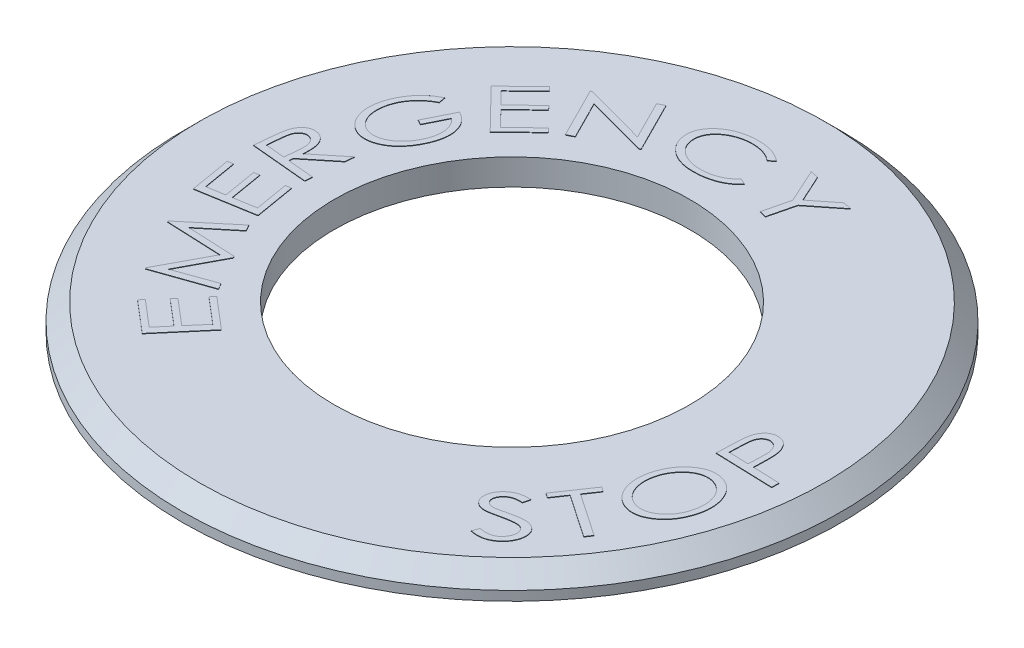
from build123d import *

# Parameters (mm, degrees)
SKETCH1_R         = 20
SKETCH1_R_2       = 10.795
EXTRUDE1_DEPTH    = 1.5875
CHAMFER1_SIZE     = 1.016
EXTRUDE3_DEPTH    = 0.508
CIRPATTERN1_COUNT = 8
SKETCH4_R         = 13.208
SKETCH4_R_2       = 11.557
EXTRUDE4_DEPTH    = 0.508
EXTRUDE5_DEPTH    = 0.0254


with BuildPart() as part:
    # Sketch1 → Extrude1 (new body)
    with BuildSketch(Plane(origin=(0, 0, 0), x_dir=(1, 0, 0), z_dir=(0, 1, 0))):
        Circle(SKETCH1_R)
        Circle(SKETCH1_R_2, mode=Mode.SUBTRACT)
    extrude(amount=EXTRUDE1_DEPTH)

    # Chamfer1
    chamfer1_edges = [part.edges().sort_by_distance(p)[0] for p in [
        (-20, 1.5875, 0),
    ]]
    chamfer(chamfer1_edges, length=CHAMFER1_SIZE)

    # Sketch3 → Extrude3 (cut)
    with BuildSketch(Plane.XZ):
        with BuildLine():
            ThreePointArc((18.07099166, 6.598477432), (11.130144468, 15.691415746), (0.254, 19.236323141))
            Line((0.254, 19.236323141), (0.254, 13.967690718))
            ThreePointArc((0.254, 13.967690718), (5.441836265, 12.866519267), (9.845405272, 9.911049139))
            Line((9.845405272, 9.911049139), (18.07099166, 6.598477432))
        make_face()
    extrude3 = extrude(amount=-EXTRUDE3_DEPTH, mode=Mode.SUBTRACT)

    # CirPattern1: Extrude3 ×8 about axis
    cirpattern1_axis = Axis((0, 24.887283079, 0), (0, -1, 0))
    for i in range(1, CIRPATTERN1_COUNT):
        add(extrude3.rotate(cirpattern1_axis, i * 360 / CIRPATTERN1_COUNT), mode=Mode.SUBTRACT)

    # Sketch4 → Extrude4 (cut)
    with BuildSketch(Plane.XZ):
        Circle(SKETCH4_R)
        Circle(SKETCH4_R_2, mode=Mode.SUBTRACT)
    extrude(amount=-EXTRUDE4_DEPTH, mode=Mode.SUBTRACT)

    # Sketch5 → Extrude5 (add)
    # profile 1 of 13: a face of its own
    with BuildSketch(Plane(origin=(0, 1.5875, 0), x_dir=(1, 0, 0), z_dir=(0, 1, 0))):
        Polygon((2.24862551, 15.919420056), (2.739207107, 15.798841714), (3.487481847, 14.161732339), (4.891702767, 15.269675048), (5.381595345, 15.149785725), (3.610816265, 13.743497747), (3.220831456, 12.15393069), (2.802596864, 12.256594535), (3.192581673, 13.846161593), align=None)
    # profile 2 of 13: a face of its own
    with BuildSketch(Plane(origin=(0, 1.5875, 0), x_dir=(1, 0, 0), z_dir=(0, 1, 0))):
        with BuildLine():
            Line((0.64804368, 15.401176133), (0.326960781, 15.160708469))
            add(Edge.make_bspline(
                [(0.326960781, 15.160708469), (0.300509182, 15.181626543), (0.247667412, 15.223414114), (0.165051543, 15.281603356), (0.078463133, 15.333605771), (-0.010446619, 15.382256657), (-0.102962938, 15.425710526), (-0.198877847, 15.4639264), (-0.297229972, 15.49889603), (-0.398953753, 15.527269579), (-0.50266578, 15.552604132), (-0.608881336, 15.571202284), (-0.716779371, 15.587049776), (-0.826769444, 15.596225768), (-0.938713366, 15.601169429), (-1.052501954, 15.601025679), (-1.168375733, 15.596408063), (-1.246093231, 15.589381811), (-1.285343906, 15.585833252)],
                knots=[0, 0, 0, 0, 0.945151009, 1.888107155, 2.829853945, 3.774676049, 4.727882376, 5.692583944, 6.667795857, 7.651975425, 8.651281675, 9.658909513, 10.673096429, 11.707031577, 12.75087939, 13.813066579, 14.895504657, 16, 16, 16, 16], degree=3))
            add(Edge.make_bspline(
                [(-1.285343906, 15.585833252), (-1.328116898, 15.580711817), (-1.413035634, 15.57054405), (-1.538445173, 15.54854018), (-1.660666211, 15.519991969), (-1.780171621, 15.486467549), (-1.896443833, 15.446357028), (-2.00996145, 15.400898455), (-2.120028297, 15.349134709), (-2.226589373, 15.292218657), (-2.328107285, 15.230344503), (-2.424044269, 15.165134706), (-2.513177795, 15.095924988), (-2.596014873, 15.023704716), (-2.672292397, 14.947773504), (-2.740974935, 14.86776281), (-2.803554472, 14.784570923), (-2.85929519, 14.698113869), (-2.907403076, 14.608592807), (-2.948113813, 14.517397851), (-2.981969881, 14.424865682), (-3.005419246, 14.329766988), (-3.023314848, 14.233192573), (-3.031711048, 14.134494412), (-3.033775349, 14.03424602), (-3.028018468, 13.967303176), (-3.025117127, 13.933565456)],
                knots=[0, 0, 0, 0, 1.163441321, 2.309821288, 3.436937546, 4.552384198, 5.660822195, 6.75751466, 7.853733283, 8.944479092, 10.019051118, 11.063511192, 12.076072233, 13.065254751, 14.03031324, 14.980421138, 15.910965776, 16.840206738, 17.756161867, 18.653117657, 19.53612776, 20.41332205, 21.295569104, 22.186346565, 23.085958612, 24, 24, 24, 24], degree=3))
            add(Edge.make_bspline(
                [(-3.025117127, 13.933565456), (-3.018356114, 13.883016522), (-3.005033313, 13.783408168), (-2.963175923, 13.639915991), (-2.906769524, 13.504269383), (-2.832735059, 13.37716333), (-2.742609843, 13.257947605), (-2.635546962, 13.147451079), (-2.512649583, 13.044983537), (-2.374655041, 12.952067255), (-2.224847376, 12.870262606), (-2.06624545, 12.800503662), (-1.899349996, 12.746633772), (-1.72552185, 12.704869917), (-1.5440256, 12.678325124), (-1.355175359, 12.665528404), (-1.158705736, 12.665845614), (-1.025761694, 12.677208988), (-0.958059835, 12.682995795)],
                knots=[0, 0, 0, 0, 0.909236007, 1.791679741, 2.658936196, 3.525960054, 4.409869183, 5.320305966, 6.266208403, 7.261161162, 8.284954758, 9.309404833, 10.349170908, 11.411184507, 12.497150281, 13.61908552, 14.787517424, 16, 16, 16, 16], degree=3))
            add(Edge.make_bspline(
                [(-0.958059835, 12.682995795), (-0.883656924, 12.692247289), (-0.737668562, 12.710399945), (-0.525671276, 12.759641366), (-0.324613355, 12.823936276), (-0.134693365, 12.905622375), (0.043721889, 13.003971911), (0.211520821, 13.117934556), (0.367578593, 13.249454647), (0.461523552, 13.348359891), (0.508861823, 13.398197618)],
                knots=[0, 0, 0, 0, 1.0761872, 2.111621752, 3.120341381, 4.104398239, 5.07581335, 6.041955416, 7.013353725, 8, 8, 8, 8], degree=3))
            Line((0.508861823, 13.398197618), (0.872663906, 13.230765977))
            add(Edge.make_bspline(
                [(0.872663906, 13.230765977), (0.847677431, 13.201582197), (0.797546892, 13.143030575), (0.716984018, 13.059287756), (0.629553041, 12.980891311), (0.537393107, 12.905866687), (0.439906117, 12.834401169), (0.336521549, 12.768012654), (0.227985342, 12.704827502), (0.1139762, 12.64676552), (-0.00479516, 12.592718277), (-0.128001818, 12.544296061), (-0.25497997, 12.499372062), (-0.386767928, 12.462493831), (-0.521856915, 12.428008565), (-0.661537693, 12.400198993), (-0.805105696, 12.376364201), (-0.902649876, 12.365384729), (-0.951858663, 12.359845838)],
                knots=[0, 0, 0, 0, 0.889118532, 1.783844702, 2.687089122, 3.605304221, 4.533512773, 5.483075042, 6.447709382, 7.439084205, 8.443020676, 9.466663456, 10.502244725, 11.558814987, 12.632773224, 13.72845557, 14.85405827, 16, 16, 16, 16], degree=3))
            add(Edge.make_bspline(
                [(-0.951858663, 12.359845838), (-0.998682467, 12.355323524), (-1.09106307, 12.346401266), (-1.228544448, 12.339893694), (-1.362748701, 12.33764052), (-1.493751175, 12.340435842), (-1.621368469, 12.347692349), (-1.745699876, 12.361017633), (-1.866847894, 12.378855854), (-1.984927987, 12.401280334), (-2.099215999, 12.429973251), (-2.210713573, 12.462083939), (-2.318902221, 12.499871878), (-2.423434614, 12.543656527), (-2.525253291, 12.590880043), (-2.623321495, 12.644328303), (-2.718243728, 12.702638191), (-2.779108738, 12.745164702), (-2.809454149, 12.766367106)],
                knots=[0, 0, 0, 0, 1.160193611, 2.288993556, 3.393840853, 4.470469865, 5.520385345, 6.54578893, 7.553687514, 8.540313299, 9.50899849, 10.459168071, 11.401604846, 12.333751936, 13.253716971, 14.168837427, 15.087038988, 16, 16, 16, 16], degree=3))
            add(Edge.make_bspline(
                [(-2.809454149, 12.766367106), (-2.857756197, 12.803823346), (-2.952421403, 12.877232297), (-3.079291838, 13.000941455), (-3.189380027, 13.132684758), (-3.282609091, 13.273242489), (-3.359491038, 13.421971649), (-3.419573954, 13.579075538), (-3.46305913, 13.744579317), (-3.478318224, 13.858473714), (-3.486070903, 13.916339979)],
                knots=[0, 0, 0, 0, 1.06535672, 2.087949019, 3.083421678, 4.054400047, 5.023608684, 5.997375685, 6.982527754, 8, 8, 8, 8], degree=3))
            add(Edge.make_bspline(
                [(-3.486070903, 13.916339979), (-3.488776164, 13.947094752), (-3.494139224, 14.008064728), (-3.494952357, 14.099186462), (-3.492118745, 14.189197755), (-3.482042655, 14.277726728), (-3.467632331, 14.365183358), (-3.448021088, 14.451227969), (-3.421170608, 14.535600344), (-3.390268276, 14.618893512), (-3.354650931, 14.701397901), (-3.312108229, 14.781692442), (-3.265530663, 14.861555902), (-3.211815006, 14.939063453), (-3.154431419, 15.016462157), (-3.090592898, 15.091630231), (-3.021394909, 15.165448836), (-2.922491307, 15.262581906), (-2.789348765, 15.377057655), (-2.616079582, 15.499313415), (-2.43085683, 15.607294026), (-2.232952712, 15.699445473), (-2.023476066, 15.777392813), (-1.80194116, 15.840849142), (-1.568158996, 15.88947008), (-1.40725148, 15.90879035), (-1.325307014, 15.918629475)],
                knots=[0, 0, 0, 0, 0.678739342, 1.345570716, 2.002708727, 2.658136146, 3.303362959, 3.951529048, 4.596973312, 5.24906391, 5.905036092, 6.571523019, 7.246360498, 7.937061089, 8.64422532, 9.364703939, 10.104472336, 10.868853525, 12.412770006, 13.960021083, 15.526373484, 17.121712754, 18.755187467, 20.437038483, 22.185510635, 24, 24, 24, 24], degree=3))
            add(Edge.make_bspline(
                [(-1.325307014, 15.918629475), (-1.275269167, 15.92318261), (-1.176234913, 15.932194116), (-1.028853326, 15.938254687), (-0.884526144, 15.937981153), (-0.743266248, 15.933360196), (-0.605196095, 15.919457992), (-0.470145206, 15.901360712), (-0.338181772, 15.876330451), (-0.20952707, 15.84565981), (-0.085091845, 15.808175216), (0.035147178, 15.766428502), (0.150068533, 15.718821425), (0.260138352, 15.666397157), (0.364979301, 15.608644514), (0.464474324, 15.544913714), (0.559125268, 15.476179996), (0.618476948, 15.426116065), (0.64804368, 15.401176133)],
                knots=[0, 0, 0, 0, 1.149283805, 2.274647493, 3.372746954, 4.450649992, 5.506194016, 6.545715671, 7.566911719, 8.57746924, 9.56987564, 10.538634505, 11.488007743, 12.413931321, 13.326385493, 14.224200412, 15.115364702, 16, 16, 16, 16], degree=3))
        make_face()
    # profile 3 of 13: a face of its own
    with BuildSketch(Plane(origin=(0, 1.5875, 0), x_dir=(1, 0, 0), z_dir=(0, 1, 0))):
        Polygon((-7.15399553, 10.393050154), (-8.689819098, 13.43369143), (-8.605069749, 13.476410614), (-4.839580383, 12.45666235), (-6.015046962, 14.784168861), (-5.631263325, 14.978472246), (-4.095439758, 11.93783097), (-4.182256164, 11.893733748), (-7.912605556, 12.894189477), (-6.751608377, 10.595621769), align=None)
    # profile 4 of 13: a face of its own
    with BuildSketch(Plane(origin=(0, 1.5875, 0), x_dir=(1, 0, 0), z_dir=(0, 1, 0))):
        Polygon((-11.95711419, 10.691587366), (-10.160152384, 12.445140968), (-9.925885891, 12.204673303), (-11.409344008, 10.75704418), (-10.664514364, 9.99430004), (-9.19414761, 11.4288378), (-8.961259155, 11.189748173), (-10.431625909, 9.755210413), (-9.498694051, 8.798851906), (-8.028327298, 10.233389666), (-7.793371785, 9.992922001), (-9.577242228, 8.252459762), align=None)
    # profile 5 of 13: a face of its own
    with BuildSketch(Plane(origin=(0, 1.5875, 0), x_dir=(1, 0, 0), z_dir=(0, 1, 0))):
        with BuildLine():
            Line((-12.752303924, 8.674896502), (-12.676511823, 8.261485043))
            add(Edge.make_bspline(
                [(-12.676511823, 8.261485043), (-12.744423481, 8.226529453), (-12.879431247, 8.157038053), (-13.070583391, 8.033427954), (-13.249141338, 7.893502876), (-13.416026915, 7.740596981), (-13.567740588, 7.5769498), (-13.703620634, 7.406710867), (-13.822842356, 7.231237409), (-13.887981337, 7.107787801), (-13.920191294, 7.046744375)],
                knots=[0, 0, 0, 0, 1.035879493, 2.059319134, 3.082877376, 4.110663053, 5.127176305, 6.107344082, 7.064118526, 8, 8, 8, 8], degree=3))
            add(Edge.make_bspline(
                [(-13.920191294, 7.046744375), (-13.938534733, 7.008580855), (-13.975137185, 6.932429463), (-14.022126648, 6.815334503), (-14.063805301, 6.697252901), (-14.099001941, 6.577664703), (-14.128064101, 6.456748803), (-14.149871834, 6.334038428), (-14.166507529, 6.21038743), (-14.176998872, 6.086210639), (-14.180147298, 5.963388792), (-14.177961167, 5.843275314), (-14.167564701, 5.727048621), (-14.150135501, 5.614818829), (-14.126844323, 5.506345515), (-14.09683587, 5.401356185), (-14.058477347, 5.300800671), (-14.014852996, 5.20427674), (-13.964322132, 5.113748786), (-13.909929274, 5.028572023), (-13.851054666, 4.94972834), (-13.786025305, 4.878745333), (-13.718404819, 4.812639012), (-13.644499278, 4.754772807), (-13.566743841, 4.702669339), (-13.511640021, 4.673308876), (-13.484042205, 4.658604184)],
                knots=[0, 0, 0, 0, 1.136687751, 2.268143927, 3.385733695, 4.49801916, 5.613889073, 6.723144366, 7.843028824, 8.963083073, 10.067407363, 11.140749563, 12.18707044, 13.19795132, 14.18861482, 15.164483529, 16.126634979, 17.075953057, 18.006189959, 18.907712296, 19.788363923, 20.64417878, 21.490340273, 22.32441474, 23.160811461, 24, 24, 24, 24], degree=3))
            add(Edge.make_bspline(
                [(-13.484042205, 4.658604184), (-13.454877698, 4.644945768), (-13.396882599, 4.617785316), (-13.305754251, 4.587142407), (-13.21254718, 4.563301564), (-13.11631517, 4.548413484), (-13.017725886, 4.540884152), (-12.916584316, 4.540801479), (-12.812925204, 4.549257986), (-12.70730136, 4.565953934), (-12.600887266, 4.589869205), (-12.495423353, 4.621603054), (-12.391294043, 4.661093139), (-12.288974318, 4.708977157), (-12.18713279, 4.763307145), (-12.087370242, 4.826152109), (-11.989268317, 4.897030244), (-11.89239218, 4.97443376), (-11.798678957, 5.058774938), (-11.708688615, 5.148650061), (-11.623444987, 5.243899107), (-11.541765207, 5.343768003), (-11.465274037, 5.449591798), (-11.393176013, 5.560606892), (-11.324317014, 5.676290995), (-11.283326896, 5.756886781), (-11.262644636, 5.797552752)],
                knots=[0, 0, 0, 0, 0.839334094, 1.669058283, 2.50298833, 3.345991009, 4.205120599, 5.079690219, 5.981091362, 6.914717857, 7.866575984, 8.823603461, 9.784821063, 10.768418942, 11.768083123, 12.793545671, 13.840855173, 14.92324356, 16.026124342, 17.127409742, 18.238749788, 19.358597349, 20.490888307, 21.642285707, 22.810375268, 24, 24, 24, 24], degree=3))
            add(Edge.make_bspline(
                [(-11.262644636, 5.797552752), (-11.239094092, 5.84713002), (-11.192883782, 5.944409343), (-11.134690316, 6.092279593), (-11.088761095, 6.238880174), (-11.051991096, 6.383357368), (-11.029118965, 6.526844403), (-11.015303094, 6.668381193), (-11.014126532, 6.808525263), (-11.023838262, 6.945783037), (-11.043009361, 7.078302), (-11.074499421, 7.203583177), (-11.11475627, 7.321299336), (-11.165921535, 7.430875226), (-11.227631271, 7.531902883), (-11.298966742, 7.625213914), (-11.381408624, 7.709784916), (-11.443083893, 7.759123797), (-11.474173499, 7.783994809)],
                knots=[0, 0, 0, 0, 1.215011973, 2.384067267, 3.514677271, 4.614811874, 5.681543946, 6.728468913, 7.76080582, 8.780325841, 9.772778561, 10.721211407, 11.636271189, 12.523481671, 13.392983988, 14.252435646, 15.119078241, 16, 16, 16, 16], degree=3))
            Line((-11.474173499, 7.783994809), (-12.090845591, 6.541693377))
            Line((-12.090845591, 6.541693377), (-12.387123803, 6.689143463))
            Line((-12.387123803, 6.689143463), (-11.553410695, 8.368283003))
            add(Edge.make_bspline(
                [(-11.553410695, 8.368283003), (-11.524277517, 8.353245368), (-11.466750115, 8.323551521), (-11.384794323, 8.273427076), (-11.306814752, 8.221083096), (-11.232776081, 8.166190781), (-11.163933514, 8.107270824), (-11.098973786, 8.045965417), (-11.038322011, 7.981726304), (-10.981397816, 7.914982986), (-10.929947382, 7.844377616), (-10.882063287, 7.771165117), (-10.83889153, 7.694947944), (-10.80001815, 7.61580264), (-10.765511167, 7.53366218), (-10.735538425, 7.448435349), (-10.708852318, 7.360534174), (-10.680884627, 7.239050555), (-10.655372926, 7.082487747), (-10.645957556, 6.88970032), (-10.653130445, 6.692214022), (-10.681080364, 6.490420509), (-10.725782311, 6.283587342), (-10.790736566, 6.072639334), (-10.873526707, 5.856623751), (-10.941262971, 5.71420723), (-10.976012692, 5.641145417)],
                knots=[0, 0, 0, 0, 0.752787015, 1.486479852, 2.204841819, 2.909594695, 3.601918919, 4.284773217, 4.960170223, 5.63018978, 6.298046233, 6.965235704, 7.638507551, 8.308506341, 8.989401811, 9.683472227, 10.38275506, 11.098011422, 12.545444724, 14.019320482, 15.523840649, 17.077845055, 18.691936542, 20.379017357, 22.142381554, 24, 24, 24, 24], degree=3))
            add(Edge.make_bspline(
                [(-10.976012692, 5.641145417), (-10.998345614, 5.59683196), (-11.042439409, 5.509340123), (-11.114748174, 5.383516002), (-11.188293296, 5.26260874), (-11.264558323, 5.147314653), (-11.344740223, 5.038400689), (-11.427516039, 4.935190292), (-11.511989262, 4.836749649), (-11.600584371, 4.74526182), (-11.691303738, 4.658913218), (-11.785316725, 4.578848664), (-11.881851156, 4.504629365), (-11.980512832, 4.434824273), (-12.083262164, 4.372771395), (-12.188211083, 4.315318244), (-12.29559298, 4.263150494), (-12.369476246, 4.233723089), (-12.406416337, 4.21901)],
                knots=[0, 0, 0, 0, 1.152682376, 2.275839169, 3.370352156, 4.440345447, 5.486251552, 6.511259425, 7.513699236, 8.498660621, 9.46870852, 10.42252109, 11.36600889, 12.297117912, 13.228731356, 14.152841999, 15.076459535, 16, 16, 16, 16], degree=3))
            add(Edge.make_bspline(
                [(-12.406416337, 4.21901), (-12.462816282, 4.19890092), (-12.57307962, 4.159587154), (-12.740876449, 4.119392368), (-12.905724791, 4.097363109), (-13.067595075, 4.091141461), (-13.226401047, 4.103733108), (-13.381794383, 4.133789706), (-13.534474796, 4.180113135), (-13.631489444, 4.224750002), (-13.680412648, 4.247259783)],
                knots=[0, 0, 0, 0, 1.093680871, 2.138174157, 3.146102297, 4.128826475, 5.092955365, 6.050299695, 7.016791929, 8, 8, 8, 8], degree=3))
            add(Edge.make_bspline(
                [(-13.680412648, 4.247259783), (-13.716153131, 4.265912699), (-13.787324388, 4.303056893), (-13.887155632, 4.369980095), (-13.981284269, 4.443765449), (-14.068997178, 4.525442861), (-14.150602942, 4.614402338), (-14.225266284, 4.711756626), (-14.294146527, 4.816517242), (-14.356551528, 4.928431361), (-14.411575711, 5.046093543), (-14.458518114, 5.168363393), (-14.497146137, 5.294770036), (-14.527399739, 5.425089996), (-14.549355671, 5.559046379), (-14.563459641, 5.696873642), (-14.56757198, 5.838642227), (-14.565276806, 5.984032342), (-14.553331427, 6.131484627), (-14.533100766, 6.280244301), (-14.50530748, 6.42997297), (-14.466693996, 6.579829259), (-14.42139001, 6.730872693), (-14.366711812, 6.882032976), (-14.304093401, 7.034422533), (-14.25601772, 7.134477331), (-14.231627926, 7.185237213)],
                knots=[0, 0, 0, 0, 0.874065192, 1.740556156, 2.602796069, 3.466589465, 4.337709824, 5.21873483, 6.125314969, 7.055495735, 7.996173555, 8.940959734, 9.894534567, 10.861450736, 11.841159265, 12.83771453, 13.864746057, 14.916287621, 15.99091477, 17.071899624, 18.172278746, 19.292547564, 20.427469389, 21.592199446, 22.778472637, 24, 24, 24, 24], degree=3))
            add(Edge.make_bspline(
                [(-14.231627926, 7.185237213), (-14.210843323, 7.226074187), (-14.169665358, 7.306979433), (-14.102213876, 7.424350789), (-14.031946375, 7.538127091), (-13.958619198, 7.648310001), (-13.880932025, 7.753940022), (-13.80054528, 7.855987667), (-13.716351453, 7.953857382), (-13.628590722, 8.048155138), (-13.536108308, 8.138199726), (-13.439470398, 8.225511534), (-13.337373616, 8.308992402), (-13.229643353, 8.388360477), (-13.118256867, 8.466293526), (-13.000557482, 8.538744951), (-12.8789047, 8.609514521), (-12.794756982, 8.652971952), (-12.752303924, 8.674896502)],
                knots=[0, 0, 0, 0, 1.028215371, 2.037075964, 3.036942629, 4.029073575, 5.006419526, 5.978860049, 6.943826847, 7.902952798, 8.868869009, 9.839709931, 10.82506949, 11.827099408, 12.842247597, 13.874884866, 14.927865911, 16, 16, 16, 16], degree=3))
        make_face()
    # profile 6 of 13: a face of its own
    with BuildSketch(Plane(origin=(0, 1.5875, 0), x_dir=(1, 0, 0), z_dir=(0, 1, 0))):
        with BuildLine():
            Line((-16.060381588, 0.374866886), (-15.979766354, 1.238896834))
            add(Edge.make_bspline(
                [(-15.979766354, 1.238896834), (-15.974434459, 1.296792529), (-15.964229538, 1.407601341), (-15.946749507, 1.566266112), (-15.929744532, 1.710078196), (-15.912526198, 1.839168015), (-15.895509291, 1.953603842), (-15.878219708, 2.053512385), (-15.861903371, 2.139044728), (-15.848190696, 2.190492009), (-15.841962535, 2.213858857)],
                knots=[0, 0, 0, 0, 1.41575692, 2.709672016, 3.886894947, 4.942048923, 5.88091931, 6.703836988, 7.411295546, 8, 8, 8, 8], degree=3))
            add(Edge.make_bspline(
                [(-15.841962535, 2.213858857), (-15.832634442, 2.24473568), (-15.81422562, 2.305670537), (-15.781632555, 2.393698163), (-15.742992749, 2.476150137), (-15.701556618, 2.554251819), (-15.654042573, 2.626939935), (-15.602973825, 2.695085479), (-15.546259447, 2.757550348), (-15.486399455, 2.815230841), (-15.422319129, 2.866287722), (-15.355213682, 2.909985992), (-15.285574753, 2.945945792), (-15.21313409, 2.974117742), (-15.137779157, 2.992805437), (-15.060405825, 3.005647919), (-14.980185581, 3.009983163), (-14.926240382, 3.006130812), (-14.89869539, 3.004163761)],
                knots=[0, 0, 0, 0, 1.152525958, 2.274489315, 3.350420918, 4.404340777, 5.43103367, 6.450385071, 7.444139454, 8.442593585, 9.418013209, 10.367289985, 11.299634166, 12.214143437, 13.137777322, 14.06878398, 15.013900594, 16, 16, 16, 16], degree=3))
            add(Edge.make_bspline(
                [(-14.89869539, 3.004163761), (-14.875908389, 3.001517066), (-14.830742586, 2.996271088), (-14.764495006, 2.982538224), (-14.700973315, 2.963071836), (-14.640096858, 2.938948901), (-14.582011491, 2.909893078), (-14.526385664, 2.875875208), (-14.473463761, 2.836557036), (-14.42301564, 2.792296968), (-14.375825365, 2.743653454), (-14.33182477, 2.690821012), (-14.292320662, 2.633542614), (-14.255166688, 2.572732974), (-14.22315275, 2.506961434), (-14.194186595, 2.437243397), (-14.168548802, 2.363468507), (-14.147336842, 2.284897888), (-14.128998226, 2.200818315), (-14.115912731, 2.110058182), (-14.105025502, 2.012435991), (-14.100288125, 1.907525642), (-14.097962496, 1.795627853), (-14.100315711, 1.676588959), (-14.106407523, 1.550662516), (-14.113634756, 1.46441723), (-14.117347734, 1.420108857)],
                knots=[0, 0, 0, 0, 0.832082324, 1.649258966, 2.450646583, 3.239853221, 4.022476947, 4.804257256, 5.602606179, 6.411626437, 7.236668453, 8.059308105, 8.903117188, 9.759182079, 10.642436718, 11.553975327, 12.497446968, 13.473905908, 14.505254721, 15.617809245, 16.799439375, 18.067859106, 19.426422366, 20.859973585, 22.386816604, 24, 24, 24, 24], degree=3))
            Line((-14.117347734, 1.420108857), (-12.381708628, 2.833287025))
            Line((-12.381708628, 2.833287025), (-12.431318003, 2.296541148))
            Line((-12.431318003, 2.296541148), (-14.166957109, 0.886808075))
            Line((-14.166957109, 0.886808075), (-14.189694739, 0.6387612))
            Line((-14.189694739, 0.6387612), (-12.598749644, 0.491311114))
            Line((-12.598749644, 0.491311114), (-12.639401771, 0.057918102))
            Line((-12.639401771, 0.057918102), (-16.060381588, 0.374866886))
        make_face()
        with BuildLine():
            Line((-15.68486618, 0.777254039), (-14.521801944, 0.66976706))
            Line((-14.521801944, 0.66976706), (-14.448076901, 1.415285723))
            add(Edge.make_bspline(
                [(-14.448076901, 1.415285723), (-14.444924792, 1.450182797), (-14.438812152, 1.517855973), (-14.432685009, 1.615961778), (-14.429084593, 1.70739767), (-14.428294336, 1.791731202), (-14.430265421, 1.869418084), (-14.43488343, 1.940012579), (-14.44234355, 2.003983387), (-14.455839436, 2.078726184), (-14.478774923, 2.163628173), (-14.518465319, 2.255569462), (-14.568181139, 2.337800939), (-14.629738348, 2.407559313), (-14.698369057, 2.466100696), (-14.774054911, 2.509977483), (-14.85502856, 2.541033837), (-14.911990809, 2.548892122), (-14.940725555, 2.552856253)],
                knots=[0, 0, 0, 0, 1.209194542, 2.344896744, 3.391917436, 4.366883406, 5.254946369, 6.073237513, 6.807650153, 7.476189425, 8.693462269, 9.833112927, 10.922019109, 11.994999994, 13.030162628, 14.021202568, 15.001790762, 16, 16, 16, 16], degree=3))
            add(Edge.make_bspline(
                [(-14.940725555, 2.552856253), (-14.969039362, 2.554266244), (-15.025209473, 2.557063445), (-15.108717503, 2.540277676), (-15.189716644, 2.510601308), (-15.266324513, 2.465358312), (-15.337485219, 2.408358086), (-15.399663576, 2.339336627), (-15.453113577, 2.260519897), (-15.490279491, 2.186900097), (-15.514567544, 2.119963829), (-15.53253107, 2.06138295), (-15.54864815, 1.994314635), (-15.564554127, 1.919462546), (-15.578903599, 1.836479933), (-15.591927467, 1.745485373), (-15.603440161, 1.646192712), (-15.610321709, 1.57721537), (-15.613897213, 1.541376218)],
                knots=[0, 0, 0, 0, 0.994876148, 1.973676783, 2.974289969, 4.021667221, 5.091568633, 6.17372047, 7.279700111, 8.43718287, 9.066709621, 9.785646208, 10.593855035, 11.494877139, 12.480205849, 13.55884577, 14.731628486, 16, 16, 16, 16], degree=3))
            Line((-15.613897213, 1.541376218), (-15.68486618, 0.777254039))
        make_face(mode=Mode.SUBTRACT)
    # profile 7 of 13: a face of its own
    with BuildSketch(Plane(origin=(0, 1.5875, 0), x_dir=(1, 0, 0), z_dir=(0, 1, 0))):
        Polygon((-15.595177998, -3.741865388), (-16.01341259, -1.273109962), (-15.681994405, -1.217299415), (-15.336795837, -3.255417905), (-14.287419752, -3.077650978), (-14.629173224, -1.057446985), (-14.300511115, -1.001636438), (-13.958757642, -3.021840431), (-12.641353129, -2.799287263), (-12.983106601, -0.77908327), (-12.652377434, -0.723272723), (-12.237587938, -3.174113652), align=None)
    # profile 8 of 13: a face of its own
    with BuildSketch(Plane(origin=(0, 1.5875, 0), x_dir=(1, 0, 0), z_dir=(0, 1, 0))):
        Polygon((-9.570866846, -8.2436985), (-12.854731863, -9.395049411), (-12.889871837, -9.333037693), (-11.325109468, -6.400572415), (-14.636535249, -6.258634481), (-14.671675223, -6.196622762), (-12.004482297, -3.959377753), (-11.791575396, -4.334204142), (-13.709115544, -5.916191989), (-10.816613374, -6.049861694), (-10.762180865, -6.145635349), (-12.134706907, -8.726011868), (-9.778950613, -7.876451321), align=None)
    # profile 9 of 13: a face of its own
    with BuildSketch(Plane(origin=(0, 1.5875, 0), x_dir=(1, 0, 0), z_dir=(0, 1, 0))):
        Polygon((-9.546503382, -12.893198823), (-11.452330205, -11.271936888), (-11.23528919, -11.016310803), (-9.661569572, -12.355074909), (-8.969794398, -11.542721393), (-10.529733634, -10.215670612), (-10.313381638, -9.961422565), (-8.753442401, -11.288473346), (-7.887345396, -10.27010312), (-9.447284632, -8.943052339), (-9.228865579, -8.686737235), (-7.336819138, -10.296285846), align=None)
    # profile 10 of 13: a face of its own
    with BuildSketch(Plane(origin=(0, 1.5875, 0), x_dir=(1, 0, 0), z_dir=(0, 1, 0))):
        with BuildLine():
            Line((10.808706093, -13.282205735), (10.955240549, -12.892382017))
            add(Edge.make_bspline(
                [(10.955240549, -12.892382017), (11.010958513, -12.902290962), (11.118381087, -12.921395113), (11.276639663, -12.93249149), (11.425041678, -12.929347901), (11.563753332, -12.908512244), (11.693544661, -12.874376541), (11.812477661, -12.821535822), (11.922927452, -12.754896909), (11.986700736, -12.698067278), (12.018842311, -12.669425286)],
                knots=[0, 0, 0, 0, 1.19892268, 2.31148718, 3.357242477, 4.338833677, 5.278680314, 6.192683563, 7.089117051, 8, 8, 8, 8], degree=3))
            add(Edge.make_bspline(
                [(12.018842311, -12.669425286), (12.044612844, -12.643024697), (12.095412232, -12.59098333), (12.161810489, -12.505287619), (12.217985034, -12.414695338), (12.263805154, -12.320352711), (12.300166559, -12.225641721), (12.321733727, -12.131700508), (12.332023129, -12.04116504), (12.32646242, -11.954476445), (12.310684503, -11.873016369), (12.284145535, -11.797758058), (12.245983475, -11.729716945), (12.212355035, -11.69107041), (12.195525004, -11.671728972)],
                knots=[0, 0, 0, 0, 1.185238393, 2.336365517, 3.476753544, 4.605700593, 5.703958271, 6.729944201, 7.696529854, 8.622099837, 9.510550309, 10.356533266, 11.177493907, 12, 12, 12, 12], degree=3))
            add(Edge.make_bspline(
                [(12.195525004, -11.671728972), (12.173844509, -11.651991156), (12.129579129, -11.61169217), (12.046567449, -11.569535114), (11.951879434, -11.540342894), (11.883980479, -11.532698237), (11.848469715, -11.528700126)],
                knots=[0, 0, 0, 0, 0.913961899, 1.866049244, 2.883956011, 4, 4, 4, 4], degree=3))
            add(Edge.make_bspline(
                [(11.848469715, -11.528700126), (11.820898038, -11.527450919), (11.762493212, -11.524804737), (11.669773879, -11.527318891), (11.567384649, -11.535519168), (11.455011496, -11.547762354), (11.333206678, -11.567659165), (11.201208747, -11.590341894), (11.059559991, -11.619272056), (10.962200443, -11.641820408), (10.911770997, -11.653499806)],
                knots=[0, 0, 0, 0, 0.698580071, 1.479795606, 2.346092603, 3.298747956, 4.340587106, 5.469946769, 6.689505211, 8, 8, 8, 8], degree=3))
            add(Edge.make_bspline(
                [(10.911770997, -11.653499806), (10.861792341, -11.665106812), (10.76618063, -11.687311605), (10.629173566, -11.716569351), (10.505577797, -11.741403406), (10.39548333, -11.761009314), (10.298788917, -11.776435983), (10.215217229, -11.785028965), (10.145059243, -11.791374481), (10.102684594, -11.79009104), (10.083746158, -11.789517434)],
                knots=[0, 0, 0, 0, 1.464248027, 2.801180926, 3.998029823, 5.061691323, 5.992702403, 6.79111566, 7.45971519, 8, 8, 8, 8], degree=3))
            add(Edge.make_bspline(
                [(10.083746158, -11.789517434), (10.055886253, -11.787907815), (10.001544418, -11.784768189), (9.922484443, -11.771869493), (9.848093265, -11.753099008), (9.778086411, -11.72812186), (9.711676393, -11.698601272), (9.650722902, -11.660649928), (9.593335391, -11.61830893), (9.559419488, -11.585200254), (9.542480132, -11.568664068)],
                knots=[0, 0, 0, 0, 1.116649168, 2.178067985, 3.20156742, 4.18408482, 5.15128979, 6.104498691, 7.053288598, 8, 8, 8, 8], degree=3))
            add(Edge.make_bspline(
                [(9.542480132, -11.568664068), (9.517529023, -11.540740844), (9.468232203, -11.485571905), (9.413858828, -11.388404353), (9.372806826, -11.284630753), (9.35022708, -11.172420399), (9.344075944, -11.055065861), (9.354881995, -10.934262821), (9.383089756, -10.810980254), (9.427128395, -10.686583804), (9.486532711, -10.56353875), (9.560757567, -10.445826898), (9.646944653, -10.333108706), (9.713951033, -10.265292086), (9.747908818, -10.230923684)],
                knots=[0, 0, 0, 0, 0.89440186, 1.767102548, 2.64960285, 3.558546241, 4.494658655, 5.455479382, 6.453581196, 7.515749486, 8.609754058, 9.718663469, 10.843854331, 12, 12, 12, 12], degree=3))
            add(Edge.make_bspline(
                [(9.747908818, -10.230923684), (9.786011853, -10.196206432), (9.861192348, -10.127706373), (9.985167794, -10.04014474), (10.116221185, -9.968142531), (10.230868686, -9.91824229), (10.328046743, -9.887745649), (10.40614452, -9.867852795), (10.489843696, -9.852837685), (10.578482105, -9.840870367), (10.672326307, -9.833178659), (10.771281946, -9.830078159), (10.875595336, -9.829718812), (10.946834952, -9.83307344), (10.98328542, -9.83478987)],
                knots=[0, 0, 0, 0, 1.383457119, 2.729677353, 4.064199281, 5.394418887, 6.079271595, 6.797811662, 7.557398035, 8.361650875, 9.199304432, 10.084877657, 11.020108338, 12, 12, 12, 12], degree=3))
            Line((10.98328542, -9.83478987), (10.872508177, -10.240739389))
            add(Edge.make_bspline(
                [(10.872508177, -10.240739389), (10.843297315, -10.239887398), (10.786752958, -10.238238174), (10.704692897, -10.238305937), (10.627983154, -10.2401503), (10.556841393, -10.244848392), (10.491145773, -10.252743767), (10.431212813, -10.262309689), (10.376535294, -10.274048103), (10.311588567, -10.29369934), (10.23538679, -10.324818469), (10.149185766, -10.371946826), (10.066748777, -10.428936789), (10.017109135, -10.474307864), (9.991899202, -10.497349966)],
                knots=[0, 0, 0, 0, 1.11000119, 2.148663212, 3.11667204, 4.024302089, 4.855660293, 5.629171286, 6.329196607, 6.977979933, 8.204482901, 9.447896909, 10.703891836, 12, 12, 12, 12], degree=3))
            add(Edge.make_bspline(
                [(9.991899202, -10.497349966), (9.9622023, -10.528090002), (9.905128572, -10.587168502), (9.837533842, -10.686023881), (9.789326888, -10.787869956), (9.766625411, -10.875619713), (9.759179437, -10.944505714), (9.758000198, -10.993881421), (9.763324534, -11.040812374), (9.772048235, -11.0856864), (9.786946918, -11.128178079), (9.807543776, -11.167870097), (9.832099023, -11.206012923), (9.85250039, -11.228422545), (9.862892792, -11.239837947)],
                knots=[0, 0, 0, 0, 1.834353445, 3.525397604, 5.120632513, 6.655369287, 7.392974993, 8.096130543, 8.772745047, 9.41885183, 10.057340922, 10.699689418, 11.337625261, 12, 12, 12, 12], degree=3))
            add(Edge.make_bspline(
                [(9.862892792, -11.239837947), (9.876574861, -11.252870363), (9.904032122, -11.279023898), (9.95164008, -11.31095372), (10.003150443, -11.338101549), (10.060856789, -11.358875608), (10.126357364, -11.372862633), (10.201616114, -11.379078607), (10.287224218, -11.380078178), (10.347628681, -11.374567409), (10.379619555, -11.371648844)],
                knots=[0, 0, 0, 0, 0.818084418, 1.641736868, 2.475798456, 3.338194701, 4.292357449, 5.371397344, 6.607862842, 8, 8, 8, 8], degree=3))
            add(Edge.make_bspline(
                [(10.379619555, -11.371648844), (10.390854916, -11.370116925), (10.418125677, -11.366398611), (10.465658484, -11.356602232), (10.52725372, -11.344386519), (10.602142729, -11.327147364), (10.690705251, -11.306775792), (10.792952663, -11.283188072), (10.908726661, -11.25476869), (10.990525717, -11.23491061), (11.03376619, -11.224413267)],
                knots=[0, 0, 0, 0, 0.405670249, 0.98465338, 1.735835323, 2.652910077, 3.734198036, 4.987867531, 6.407731876, 8, 8, 8, 8], degree=3))
            add(Edge.make_bspline(
                [(11.03376619, -11.224413267), (11.086070199, -11.212062697), (11.187176257, -11.188188476), (11.334281837, -11.156839724), (11.472131937, -11.133210946), (11.599961115, -11.114671703), (11.718080932, -11.102378933), (11.826419059, -11.096903942), (11.925037881, -11.09591863), (12.014717968, -11.103430035), (12.097153921, -11.115344109), (12.174103212, -11.131888913), (12.246298256, -11.153791886), (12.313553168, -11.180397168), (12.376522596, -11.211377051), (12.434813017, -11.246863118), (12.487854985, -11.287931653), (12.519703641, -11.318540463), (12.535569074, -11.333788267)],
                knots=[0, 0, 0, 0, 1.639585727, 3.169394673, 4.587741384, 5.905631249, 7.109585162, 8.209082876, 9.214410274, 10.115612865, 10.951525284, 11.754273818, 12.514378006, 13.250529178, 13.958411039, 14.652989821, 15.328985773, 16, 16, 16, 16], degree=3))
            add(Edge.make_bspline(
                [(12.535569074, -11.333788267), (12.556524577, -11.357126825), (12.597899385, -11.403206768), (12.648865471, -11.480835057), (12.688994626, -11.56409163), (12.718642415, -11.653176732), (12.737246367, -11.748108329), (12.74663994, -11.848451687), (12.743648934, -11.954592526), (12.731973254, -12.064596635), (12.710342135, -12.176301074), (12.678884297, -12.286407323), (12.63724735, -12.393625506), (12.585448547, -12.49762604), (12.525449402, -12.599594849), (12.454604833, -12.697948814), (12.374704053, -12.79383072), (12.314966231, -12.853569373), (12.284567472, -12.883968556)],
                knots=[0, 0, 0, 0, 0.866634554, 1.711094121, 2.558221657, 3.416790263, 4.300423951, 5.228639804, 6.198488116, 7.232179932, 8.285712401, 9.341483544, 10.395491881, 11.462268422, 12.552064878, 13.664235885, 14.811400745, 16, 16, 16, 16], degree=3))
            add(Edge.make_bspline(
                [(12.284567472, -12.883968556), (12.260310163, -12.906726741), (12.212299935, -12.951769895), (12.136077447, -13.013040071), (12.059034371, -13.070599148), (11.97906096, -13.121332045), (11.897422129, -13.167570222), (11.813208583, -13.207044539), (11.727538983, -13.242487915), (11.639591452, -13.272265799), (11.548567958, -13.295151995), (11.454311597, -13.313265676), (11.355786725, -13.323023767), (11.253503225, -13.328490518), (11.147459565, -13.325619328), (11.037639057, -13.318330772), (10.924217515, -13.303229052), (10.847680805, -13.289299213), (10.808706093, -13.282205735)],
                knots=[0, 0, 0, 0, 0.998479279, 1.976196953, 2.934914178, 3.884961123, 4.818164896, 5.750523806, 6.675856551, 7.601322358, 8.535818347, 9.492478348, 10.480643813, 11.506471751, 12.566422575, 13.663973463, 14.810427579, 16, 16, 16, 16], degree=3))
        make_face()
    # profile 11 of 13: a face of its own
    with BuildSketch(Plane(origin=(0, 1.5875, 0), x_dir=(1, 0, 0), z_dir=(0, 1, 0))):
        Polygon((11.373720617, -9.227794344), (11.095375265, -9.037790337), (12.470275104, -7.022065177), (12.748620457, -7.212069183), (12.189826386, -8.031680562), (14.779770297, -9.798507485), (14.524561963, -10.172906523), (11.934618053, -8.4060796), align=None)
    # profile 12 of 13: a face of its own
    with BuildSketch(Plane(origin=(0, 1.5875, 0), x_dir=(1, 0, 0), z_dir=(0, 1, 0))):
        with BuildLine():
            add(Edge.make_bspline(
                [(13.2469078, -4.573094005), (13.275006959, -4.495759221), (13.330111787, -4.344099164), (13.430254919, -4.128187893), (13.542792057, -3.927316538), (13.667297796, -3.741413569), (13.804295721, -3.570439862), (13.953025692, -3.414141666), (14.114909265, -3.273499807), (14.259349456, -3.169625553), (14.378692278, -3.094934748), (14.4686611, -3.044190354), (14.558706324, -2.99934297), (14.649044172, -2.96084762), (14.738899538, -2.926719291), (14.829337939, -2.89888062), (14.919813395, -2.876024693), (15.010592149, -2.860305343), (15.101102963, -2.848831661), (15.191739816, -2.842937782), (15.282340901, -2.844205367), (15.37325886, -2.849250576), (15.463986784, -2.861716494), (15.555196136, -2.878232252), (15.646129818, -2.901587538), (15.706297029, -2.920728262), (15.736591294, -2.93036564)],
                knots=[0, 0, 0, 0, 1.785990305, 3.50247813, 5.161069843, 6.781048566, 8.354997278, 9.912730303, 11.45944744, 13.004440417, 13.770421469, 14.515681754, 15.246443835, 15.953419753, 16.647140133, 17.332513718, 18.006979407, 18.671928179, 19.331569484, 19.987452343, 20.642097258, 21.297980116, 21.963296696, 22.629154939, 23.30977783, 24, 24, 24, 24], degree=3))
            add(Edge.make_bspline(
                [(15.736591294, -2.93036564), (15.766181312, -2.940984418), (15.825127269, -2.962137972), (15.910278442, -3.000075782), (15.992069676, -3.042466189), (16.070590619, -3.088637825), (16.145979379, -3.139141858), (16.217417151, -3.194705319), (16.285540699, -3.254403391), (16.350412441, -3.318333054), (16.411053597, -3.387117468), (16.468948521, -3.459815331), (16.523902168, -3.536659461), (16.573724822, -3.619086795), (16.622020626, -3.704734289), (16.666086234, -3.79540627), (16.706451986, -3.890538572), (16.756148093, -4.022560488), (16.807346448, -4.192388173), (16.850272755, -4.401243494), (16.874966366, -4.613316731), (16.880428638, -4.828937285), (16.866958285, -5.047798247), (16.834013364, -5.269668308), (16.783963097, -5.495404821), (16.736191286, -5.644278586), (16.711851711, -5.720129261)],
                knots=[0, 0, 0, 0, 0.689875106, 1.374292783, 2.044254228, 2.711144787, 3.372746332, 4.034586492, 4.696207925, 5.360033214, 6.032288618, 6.707668446, 7.399429214, 8.104173701, 8.820676003, 9.557137783, 10.315604094, 11.088335325, 12.652820203, 14.203187462, 15.762795067, 17.333089216, 18.931471194, 20.569613724, 22.252229903, 24, 24, 24, 24], degree=3))
            add(Edge.make_bspline(
                [(16.711851711, -5.720129261), (16.684196712, -5.795820745), (16.629907835, -5.944408918), (16.531083921, -6.156419992), (16.419596185, -6.353727439), (16.29581435, -6.537058182), (16.159572851, -6.70597228), (16.010394615, -6.860220024), (15.848271342, -6.99960119), (15.67573778, -7.12329631), (15.497596459, -7.229544367), (15.317042873, -7.313500194), (15.137106513, -7.376576819), (14.956737695, -7.415752201), (14.776666998, -7.434302544), (14.597041506, -7.427751994), (14.41725549, -7.401391463), (14.300788909, -7.365574114), (14.241799627, -7.347432947)],
                knots=[0, 0, 0, 0, 1.178583488, 2.313649552, 3.417600404, 4.491129864, 5.54631568, 6.588508112, 7.626198078, 8.669976626, 9.690907535, 10.656178757, 11.578541123, 12.474562187, 13.350646163, 14.219561357, 15.098223751, 16, 16, 16, 16], degree=3))
            add(Edge.make_bspline(
                [(14.241799627, -7.347432947), (14.202995028, -7.333070159), (14.126039925, -7.304586684), (14.015239152, -7.251500074), (13.909869561, -7.189573396), (13.809657776, -7.119328465), (13.714189234, -7.041353096), (13.625449881, -6.953777931), (13.540654695, -6.858820885), (13.462096103, -6.755562654), (13.38998373, -6.645656242), (13.325540545, -6.530525526), (13.268430833, -6.410917842), (13.219406149, -6.286480394), (13.177725821, -6.157310445), (13.145338804, -6.023094337), (13.119095346, -5.884623943), (13.100935604, -5.742046795), (13.091432648, -5.596883468), (13.089285696, -5.450855342), (13.094790261, -5.304554058), (13.108760409, -5.158233668), (13.131548052, -5.011799817), (13.161785527, -4.865350461), (13.199191349, -4.718390996), (13.23092184, -4.621771385), (13.2469078, -4.573094005)],
                knots=[0, 0, 0, 0, 0.910997726, 1.806639592, 2.701837581, 3.600064363, 4.499720728, 5.413390433, 6.343158751, 7.301665539, 8.268224429, 9.236180418, 10.205517825, 11.185295764, 12.179943258, 13.192452155, 14.224247681, 15.28283965, 16.355949902, 17.426748972, 18.498228319, 19.578978215, 20.662262685, 21.76063179, 22.871796555, 24, 24, 24, 24], degree=3))
        make_face()
        with BuildLine():
            add(Edge.make_bspline(
                [(13.575733922, -4.663538716), (13.563169308, -4.702211796), (13.538218858, -4.779007684), (13.508177311, -4.896075339), (13.484086613, -5.013491493), (13.467683897, -5.131809747), (13.456011366, -5.250134497), (13.451790395, -5.369323581), (13.455047231, -5.488884765), (13.463081289, -5.60826321), (13.477704775, -5.725557097), (13.498610686, -5.839381925), (13.52615567, -5.948855772), (13.558896816, -6.05438794), (13.598247438, -6.155596195), (13.64379363, -6.252299541), (13.695368711, -6.344801174), (13.752463263, -6.432870777), (13.815367011, -6.515296033), (13.88321694, -6.591821903), (13.955910053, -6.661657798), (14.033269467, -6.725322018), (14.116036487, -6.78138201), (14.202718835, -6.831966904), (14.294576812, -6.876058262), (14.358673148, -6.899474591), (14.391138569, -6.911335191)],
                knots=[0, 0, 0, 0, 1.103430233, 2.191159988, 3.278427253, 4.354908977, 5.431708366, 6.50438953, 7.589378475, 8.676738254, 9.75069401, 10.795768725, 11.815767112, 12.812865471, 13.792930336, 14.760537949, 15.711810893, 16.665407368, 17.606773384, 18.523364544, 19.438549888, 20.340092174, 21.239154039, 22.148694392, 23.062295608, 24, 24, 24, 24], degree=3))
            add(Edge.make_bspline(
                [(14.391138569, -6.911335191), (14.439666529, -6.926434811), (14.535220587, -6.956166742), (14.682759503, -6.977700478), (14.829594757, -6.983285752), (14.976449867, -6.969288613), (15.123299017, -6.938673042), (15.269145238, -6.887636779), (15.415069759, -6.81993109), (15.55882665, -6.734550096), (15.697644007, -6.635277528), (15.82809857, -6.524118148), (15.947798059, -6.401621009), (16.056505025, -6.267678243), (16.155944915, -6.123540698), (16.244240369, -5.96787937), (16.322462061, -5.801376352), (16.365418238, -5.684718974), (16.387232319, -5.625477819)],
                knots=[0, 0, 0, 0, 0.924846414, 1.821070362, 2.707374226, 3.596864553, 4.502269218, 5.434226333, 6.405958203, 7.429217202, 8.476268767, 9.512350487, 10.548318421, 11.592560176, 12.65215513, 13.735539832, 14.850057848, 16, 16, 16, 16], degree=3))
            add(Edge.make_bspline(
                [(16.387232319, -5.625477819), (16.400551655, -5.584950761), (16.426918167, -5.504724748), (16.457977315, -5.38306102), (16.483854241, -5.262013887), (16.50163394, -5.141129527), (16.513851521, -5.02041272), (16.519314176, -4.900115597), (16.518907923, -4.780032062), (16.510971694, -4.661145395), (16.497211224, -4.544306041), (16.476769755, -4.431069576), (16.451150574, -4.321496865), (16.417919804, -4.216779632), (16.379669095, -4.115699867), (16.333623177, -4.019786947), (16.282573977, -3.927464516), (16.224986277, -3.839941221), (16.162351729, -3.757577174), (16.09469396, -3.681312166), (16.022231677, -3.611715639), (15.945107692, -3.548292502), (15.862667842, -3.492306768), (15.776047186, -3.442247398), (15.684701694, -3.398366397), (15.620879928, -3.37483794), (15.588654595, -3.362957787)],
                knots=[0, 0, 0, 0, 1.151480166, 2.2794317, 3.388265536, 4.492151004, 5.576476195, 6.662965674, 7.741990309, 8.816929782, 9.878226013, 10.916691922, 11.9222181, 12.914089593, 13.880855606, 14.837686276, 15.783972574, 16.72728786, 17.663719163, 18.575505482, 19.47697143, 20.373787762, 21.268136675, 22.164286807, 23.073098855, 24, 24, 24, 24], degree=3))
            add(Edge.make_bspline(
                [(15.588654595, -3.362957787), (15.556072011, -3.352658262), (15.491742651, -3.332323414), (15.393542161, -3.310460837), (15.295043186, -3.297009443), (15.196294568, -3.292293616), (15.097383086, -3.295126665), (14.998400742, -3.30553204), (14.899189243, -3.324539361), (14.800545453, -3.352334231), (14.702334225, -3.386238072), (14.60626731, -3.428743366), (14.511858599, -3.477744231), (14.419968425, -3.535087184), (14.329487404, -3.598828008), (14.240777885, -3.669798668), (14.154755562, -3.748851204), (14.070182856, -3.833504943), (13.990453562, -3.924522764), (13.914074067, -4.018417067), (13.84391363, -4.116814574), (13.77967272, -4.219083928), (13.720408312, -4.324828139), (13.666485537, -4.434069957), (13.617916184, -4.547165644), (13.589848779, -4.624598431), (13.575733922, -4.663538716)],
                knots=[0, 0, 0, 0, 0.925113993, 1.826496975, 2.720718486, 3.614245351, 4.500705449, 5.398168969, 6.306811292, 7.232747666, 8.171552195, 9.118175626, 10.075048138, 11.049879777, 12.04906364, 13.071138671, 14.124026455, 15.211575668, 16.310119761, 17.399417225, 18.488346869, 19.58058243, 20.668702433, 21.769796201, 22.878449613, 24, 24, 24, 24], degree=3))
        make_face(mode=Mode.SUBTRACT)
    # profile 13 of 13: a face of its own
    with BuildSketch(Plane(origin=(0, 1.5875, 0), x_dir=(1, 0, 0), z_dir=(0, 1, 0))):
        with BuildLine():
            Line((14.151581517, -1.761600706), (14.181028633, -0.876083879))
            add(Edge.make_bspline(
                [(14.181028633, -0.876083879), (14.183279418, -0.815082922), (14.187583328, -0.698438017), (14.195108561, -0.531308138), (14.204098952, -0.379604468), (14.214634937, -0.243590421), (14.225577829, -0.122921015), (14.238035118, -0.017925978), (14.251542916, 0.071714785), (14.262850775, 0.125857924), (14.267967735, 0.150358428)],
                knots=[0, 0, 0, 0, 1.420611484, 2.716467059, 3.893409364, 4.957140815, 5.891266265, 6.712964133, 7.417598816, 8, 8, 8, 8], degree=3))
            add(Edge.make_bspline(
                [(14.267967735, 0.150358428), (14.275567259, 0.181299887), (14.290483954, 0.2420332), (14.318480653, 0.330318671), (14.352438276, 0.413671612), (14.3901573, 0.492911601), (14.432038843, 0.567930856), (14.480249041, 0.637220052), (14.532168635, 0.70283849), (14.588545515, 0.763722098), (14.649561799, 0.818406368), (14.713827646, 0.866306759), (14.781985057, 0.906135558), (14.853587751, 0.93759974), (14.928618063, 0.961457122), (15.006470564, 0.978540387), (15.088088678, 0.987048298), (15.143419398, 0.986417948), (15.171713729, 0.986095608)],
                knots=[0, 0, 0, 0, 1.138203748, 2.234118497, 3.305583583, 4.351361383, 5.368442447, 6.371336526, 7.363747104, 8.356333315, 9.33202185, 10.2873087, 11.215346782, 12.146272977, 13.075812497, 14.02410323, 14.989590647, 16, 16, 16, 16], degree=3))
            add(Edge.make_bspline(
                [(15.171713729, 0.986095608), (15.200055, 0.984593582), (15.255661188, 0.981646574), (15.336828845, 0.967017414), (15.414120014, 0.946183481), (15.487650085, 0.918178293), (15.556586223, 0.882075639), (15.621472659, 0.839115117), (15.682262351, 0.788763532), (15.738901128, 0.731466484), (15.790362917, 0.667228408), (15.838654616, 0.598672946), (15.880445383, 0.523569753), (15.918346222, 0.443782623), (15.951461573, 0.358502318), (15.979096724, 0.267681848), (16.003575294, 0.171678755), (16.014494815, 0.105120867), (16.020071101, 0.071131665)],
                knots=[0, 0, 0, 0, 0.996073099, 1.954316992, 2.89032482, 3.805066897, 4.712003013, 5.618195738, 6.53371107, 7.479923358, 8.442797832, 9.422016609, 10.421938824, 11.457486717, 12.523119953, 13.631866107, 14.79066206, 16, 16, 16, 16], degree=3))
            add(Edge.make_bspline(
                [(16.020071101, 0.071131665), (16.023807225, 0.043112616), (16.032007498, -0.018385297), (16.039943082, -0.119227902), (16.04521109, -0.236380036), (16.048576342, -0.369853475), (16.050063081, -0.519680737), (16.048270314, -0.685859325), (16.044832417, -0.868393769), (16.041001536, -0.995511505), (16.039001389, -1.061881155)],
                knots=[0, 0, 0, 0, 0.597990969, 1.312506931, 2.139231607, 3.079064446, 4.137292881, 5.309246696, 6.595126357, 8, 8, 8, 8], degree=3))
            Line((16.039001389, -1.061881155), (16.028484562, -1.378788206))
            Line((16.028484562, -1.378788206), (17.647374786, -1.432774585))
            Line((17.647374786, -1.432774585), (17.632651229, -1.877285802))
            Line((17.632651229, -1.877285802), (14.151581517, -1.761600706))
        make_face()
        with BuildLine():
            Line((14.504946902, -1.328307437), (15.68773937, -1.367570258))
            Line((15.68773937, -1.367570258), (15.720692094, -0.615266572))
            add(Edge.make_bspline(
                [(15.720692094, -0.615266572), (15.721864009, -0.578344105), (15.724118486, -0.507314338), (15.723571727, -0.404457224), (15.722727888, -0.309303291), (15.718709723, -0.221579716), (15.711321465, -0.141685506), (15.703482236, -0.069054559), (15.692358543, -0.004219435), (15.674853294, 0.071071342), (15.6465652, 0.155624988), (15.601456117, 0.246871131), (15.546557617, 0.327760745), (15.480303427, 0.395250528), (15.407532971, 0.451450905), (15.328272418, 0.492496958), (15.243895088, 0.518950408), (15.185687792, 0.52374042), (15.156289049, 0.52615971)],
                knots=[0, 0, 0, 0, 1.241838704, 2.388992985, 3.457690596, 4.440974023, 5.340136775, 6.154904462, 6.896361405, 7.550070868, 8.75266213, 9.88412925, 10.962974635, 12.024281341, 13.050453669, 14.041460768, 15.010801139, 16, 16, 16, 16], degree=3))
            add(Edge.make_bspline(
                [(15.156289049, 0.52615971), (15.127643817, 0.525944462), (15.070502535, 0.525515086), (14.986566182, 0.503457245), (14.905565067, 0.468248112), (14.829632128, 0.417428717), (14.760554459, 0.354460658), (14.700006622, 0.280826377), (14.651092527, 0.196231323), (14.618138217, 0.118343788), (14.596963875, 0.048456091), (14.582344529, -0.012386054), (14.570008069, -0.081503484), (14.558965069, -0.158452671), (14.549007883, -0.243290503), (14.541722169, -0.335924931), (14.535084112, -0.436409889), (14.532784784, -0.506115168), (14.53158953, -0.542349905)],
                knots=[0, 0, 0, 0, 0.986719625, 1.968300482, 2.973886343, 4.029153692, 5.109960324, 6.194985107, 7.310260692, 8.476001124, 9.109707535, 9.832686418, 10.637583288, 11.535525327, 12.519496562, 13.589502138, 14.746956376, 16, 16, 16, 16], degree=3))
            Line((14.53158953, -0.542349905), (14.504946902, -1.328307437))
        make_face(mode=Mode.SUBTRACT)
    extrude(amount=EXTRUDE5_DEPTH)


solid = part.part
